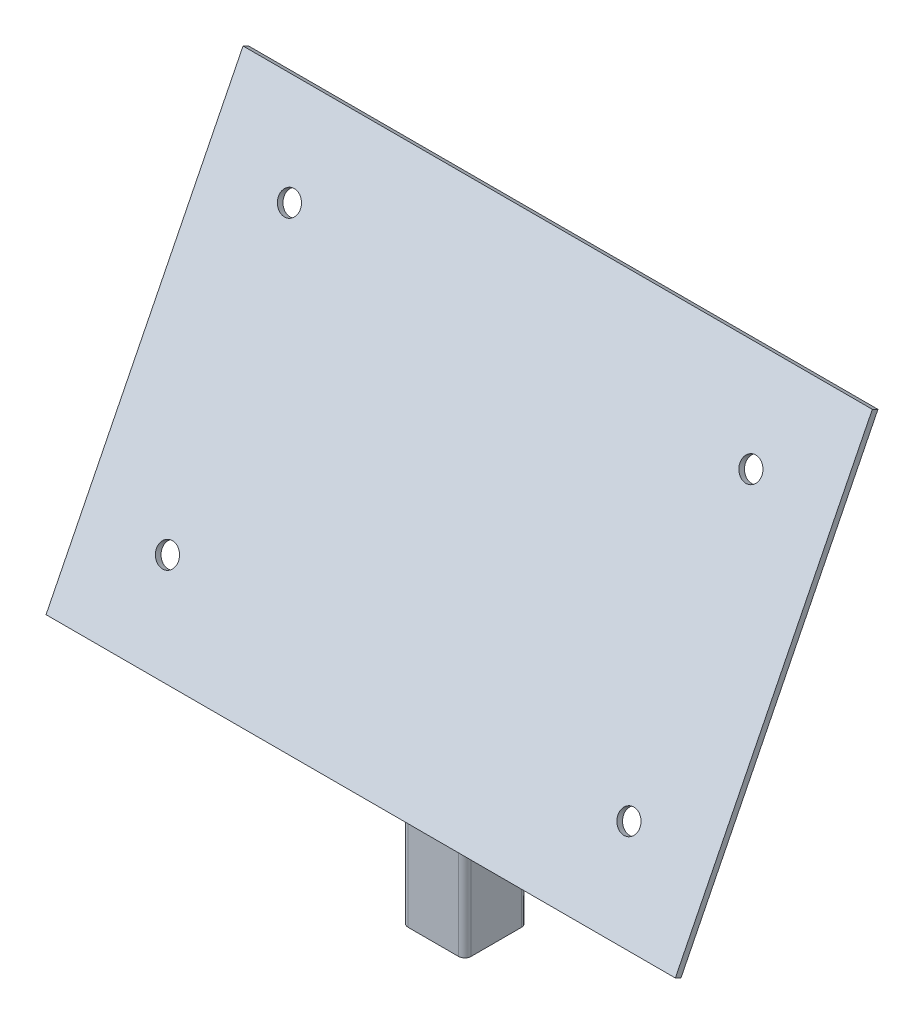
from build123d import *

# Parameters (mm, degrees)
BOSS_EXTRU_1_DEPTH           = 200
ENL_V_MAT_EXTRU_1_DEPTH      = 100
ESQUISSE3_W                  = 300
ESQUISSE3_H                  = 210
BOSS_EXTRU_2_DEPTH           = 3
ENL_V_MAT_EXTRU_2_DEPTH      = 299.654946406
ENL_V_MAT_EXTRU_2_DEPTH_BACK = 299.654946406
ESQUISSE4_R                  = 5.25


with BuildPart() as part:
    # Esquisse1 → Boss.-Extru.1 (new body)
    with BuildSketch(Plane(origin=(0, 0, 0), x_dir=(1, 0, 0), z_dir=(0, 1, 0))):
        with BuildLine():
            Line((-12, -15), (12, -15))
            ThreePointArc((12, -15), (14.121320344, -14.121320344), (15, -12))
            Line((15, -12), (15, 12))
            ThreePointArc((15, 12), (14.121320344, 14.121320344), (12, 15))
            Line((12, 15), (-12, 15))
            ThreePointArc((-12, 15), (-14.121320344, 14.121320344), (-15, 12))
            Line((-15, 12), (-15, -12))
            ThreePointArc((-15, -12), (-14.121320344, -14.121320344), (-12, -15))
        make_face()
        with BuildLine():
            Line((-10, -13), (10, -13))
            ThreePointArc((10, -13), (12.121320344, -12.121320344), (13, -10))
            Line((13, -10), (13, 10))
            ThreePointArc((13, 10), (12.121320344, 12.121320344), (10, 13))
            Line((10, 13), (-10, 13))
            ThreePointArc((-10, 13), (-12.121320344, 12.121320344), (-13, 10))
            Line((-13, 10), (-13, -10))
            ThreePointArc((-13, -10), (-12.121320344, -12.121320344), (-10, -13))
        make_face(mode=Mode.SUBTRACT)
    extrude(amount=BOSS_EXTRU_1_DEPTH)

    # Esquisse2 → Enlèv. mat.-Extru.1 (cut)
    with BuildSketch(Plane(origin=(15, 0, 0), x_dir=(0, 0, -1), z_dir=(1, 0, 0))):
        Polygon((15, 200), (-15, 140), (-15, 200), align=None)
    extrude(amount=-ENL_V_MAT_EXTRU_1_DEPTH, mode=Mode.SUBTRACT)

    # Esquisse3 → Boss.-Extru.2 (add)
    with BuildSketch(Plane(origin=(0, 34, 68), x_dir=(1, 0, 0), z_dir=(0, 0.447213595499958, 0.8944271909999159))):
        with Locations((0, 152.05262247)):
            Rectangle(ESQUISSE3_W, ESQUISSE3_H)
    extrude(amount=BOSS_EXTRU_2_DEPTH)

    # Esquisse4 → Enlèv. mat.-Extru.2 (cut, two sides: drawn at the far end of the back side and taken through both)
    with BuildSketch(Plane(origin=(0, 34, 68), x_dir=(1, 0, 0), z_dir=(0, 0.447213595499958, 0.8944271909999159)).offset(-ENL_V_MAT_EXTRU_2_DEPTH_BACK)):
        with Locations(Location((-110, 217.05262247, 0), (0, 0, 90))):
            Circle(ESQUISSE4_R)
        with Locations(Location((110, 217.05262247, 0), (0, 0, 90))):
            Circle(ESQUISSE4_R)
        with Locations(Location((110, 87.05262247, 0), (0, 0, 90))):
            Circle(ESQUISSE4_R)
        with Locations(Location((-110, 87.05262247, 0), (0, 0, 90))):
            Circle(ESQUISSE4_R)
    extrude(amount=ENL_V_MAT_EXTRU_2_DEPTH + ENL_V_MAT_EXTRU_2_DEPTH_BACK, mode=Mode.SUBTRACT)


solid = part.part
